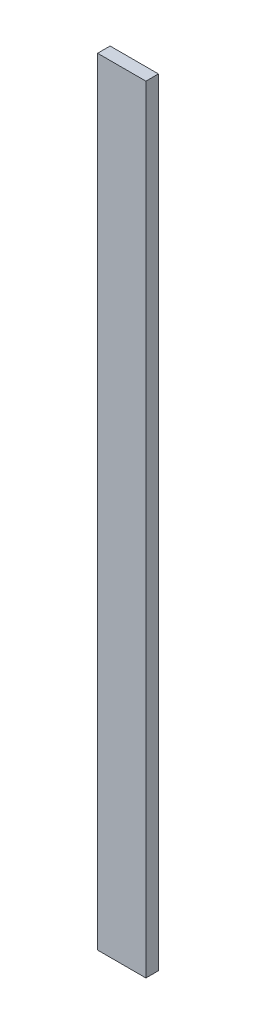
from build123d import *

# Parameters (mm, degrees)
SKETCH1_W           = 49
SKETCH1_H           = 12.7
BOSS_EXTRUDE1_DEPTH = 787.4


with BuildPart() as part:
    # Sketch1 → Boss-Extrude1 (new body)
    with BuildSketch(Plane(origin=(0, 0, 0), x_dir=(1, 0, 0), z_dir=(0, 1, 0))):
        Rectangle(SKETCH1_W, SKETCH1_H)
    extrude(amount=BOSS_EXTRUDE1_DEPTH)


solid = part.part
